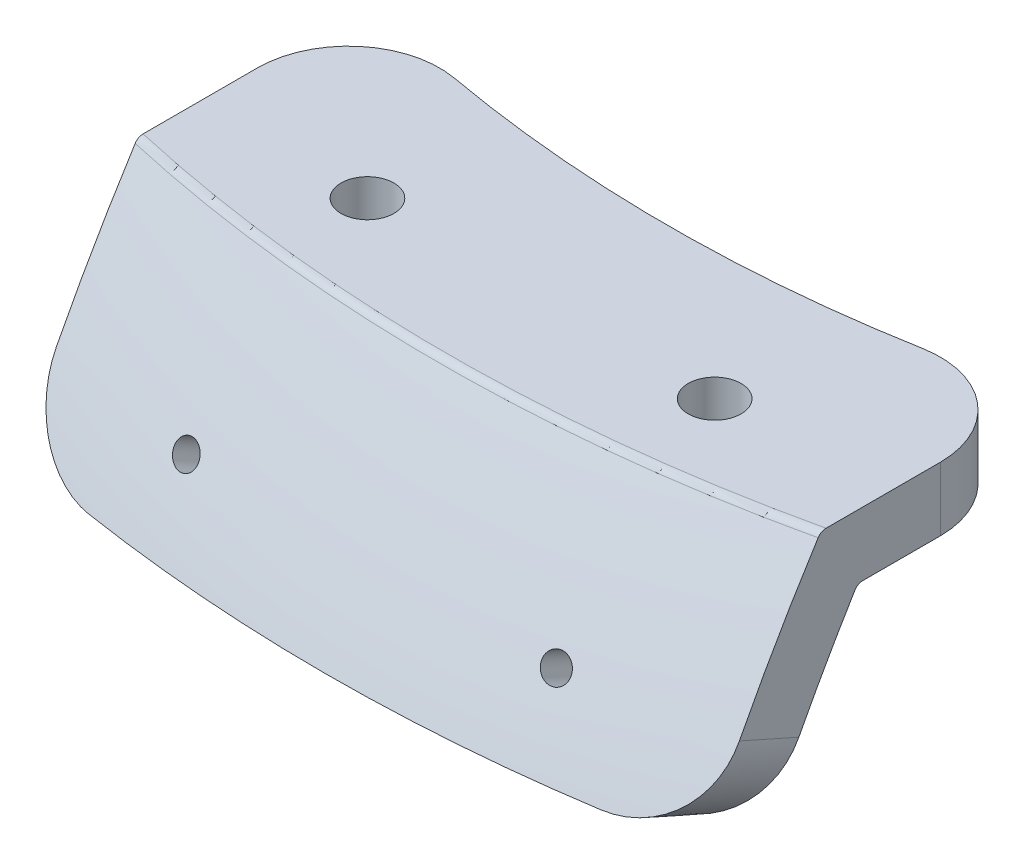
from build123d import *

# Parameters (mm, degrees)
REVOLVE1_ANGLE     = 30.000000000000068
SKETCH5_OUTSIDE_W  = 117.778
SKETCH5_OUTSIDE_H  = 65.886
CUT_EXTRUDE2_DEPTH = 260.76149135356775
FILLET1_R          = 10
FILLET2_R          = 1
SKETCH6_R          = 2.9000000000000363
CUT_EXTRUDE3_DEPTH = 189.07070419365607


with BuildPart() as part:
    # Sketch1 → Revolve1 (revolve, symmetric)
    with BuildSketch(Plane(origin=(0, 0, 0), x_dir=(0, 0, -1), z_dir=(1, 0, 0))) as revolve1_sk:
        with BuildLine():
            Line((-182.35774731109075, 155.06255495822683), (-175.97602387063264, 152.18616730537))
            ThreePointArc((-175.97602387063264, 152.18616730537), (-171.12326361620543, 162.17531665611477), (-165.70405663890074, 171.86884968466347))
            Line((-165.70405663890074, 171.86884968466347), (-144.78715490957802, 171.8688496846635))
            Line((-144.78715490957802, 171.8688496846635), (-144.78715490957802, 178.86884968466353))
            Line((-144.78715490957802, 178.86884968466353), (-169.62958875117425, 178.8688496846635))
            ThreePointArc((-169.62958875117425, 178.8688496846635), (-176.3957372053048, 167.18067068421345), (-182.35774731109075, 155.06255495822683))
        make_face()
    revolve(axis=Axis((0, 0, 0), (0, 1, 0)), revolution_arc=REVOLVE1_ANGLE / 2)
    revolve(revolve1_sk.sketch, axis=Axis((0, 0, 0), (0, -1, 0)), revolution_arc=REVOLVE1_ANGLE / 2)

    # Sketch4 → Cut-Revolve1 (revolve, cut)
    with BuildSketch(Plane(origin=(0, 57.85077924674397, -29.47644429930001), x_dir=(0, 0.4539904997395446, 0.891006524188369), z_dir=(0, -0.891006524188369, 0.4539904997395446)), mode=Mode.PRIVATE) as cut_revolve1_sk:
        Polygon((200.3216852155454, 19.031606271083962), (239.0176946479082, 22.417068420107935), (239.1484282620297, 20.922776372970326), (200.4524188296669, 17.53731422394635), align=None)
    cut_revolve1 = revolve(cut_revolve1_sk.sketch.rotate(Axis((-17.53731422394635, 148.85427304522494, 149.12796866727265), (-0.08715574274765833, 0.4522629288245563, 0.8876159753616077)), 8.229125289), axis=Axis((-17.53731422394635, 148.85427304522494, 149.12796866727265), (-0.08715574274765833, 0.4522629288245563, 0.8876159753616077)), mode=Mode.SUBTRACT)

    # Mirror1: Cut-Revolve1 across plane
    add(cut_revolve1.mirror(Plane(origin=(0, 0, 0), x_dir=(0, 0, 1), z_dir=(1, 0, 0))), mode=Mode.SUBTRACT)

    # Sketch5 outside → Cut-Extrude2 (cut, through all)
    with BuildSketch(Plane(origin=(0, 0, 0), x_dir=(1, 0, 0), z_dir=(0, 1, 0))):
        with Locations((0, -161.106)):
            Rectangle(SKETCH5_OUTSIDE_W, SKETCH5_OUTSIDE_H)
        Polygon((37.473673176807814, -139.85365224207746), (-37.473673176807814, -139.85365224207746), (-37.47367317680781, -182.35774731109072), (37.47367317680782, -182.35774731109072), align=None, mode=Mode.SUBTRACT)
    extrude(amount=CUT_EXTRUDE2_DEPTH, mode=Mode.SUBTRACT)

    # Fillet1
    fillet1_edges = [part.edges().sort_by_distance(p)[0] for p in [
        (37.47367317680782, 175.36884968466353, 139.85365224207746),
        (37.47367317680782, 153.6238703887916, 175.2030438132355),
        (-37.47367317680781, 153.6238703887916, 175.20304381323552),
        (-37.47367317680782, 175.36884968466353, 139.85365224207746),
    ]]
    fillet(fillet1_edges, radius=FILLET1_R)

    # Fillet2
    fillet2_edges = [part.edges().sort_by_distance(p)[0] for p in [
        (2.132e-14, 178.86884968466353, 169.62958875117428),
        (1.421e-14, 171.86884968466347, 165.7040566389007),
    ]]
    fillet(fillet2_edges, radius=FILLET2_R)

    # Sketch6 → Cut-Extrude3 (cut, through all)
    with BuildSketch(Plane(origin=(0, 178.8688496846635, 0), x_dir=(1, 0, 0), z_dir=(0, 1, 0))):
        with Locations(Location((19.049999999999898, -158.67424557151682, 0), (0, 0, 270))):
            Circle(SKETCH6_R)
        with Locations(Location((-19.050000000000104, -158.67424557151682, 0), (0, 0, 270))):
            Circle(SKETCH6_R)
    extrude(amount=-CUT_EXTRUDE3_DEPTH, mode=Mode.SUBTRACT)


solid = part.part
